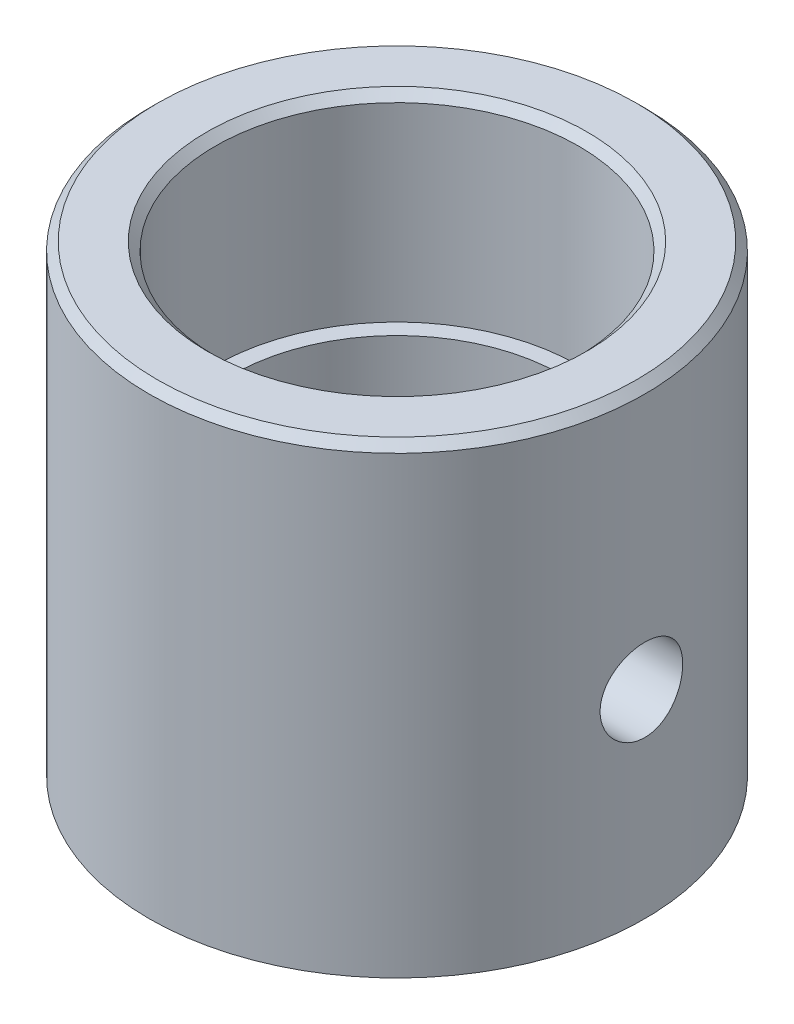
from build123d import *

# Parameters (mm, degrees)
SKETCH1_R           = 15
BOSS_EXTRUDE1_DEPTH = 28
SKETCH2_R           = 10
CUT_EXTRUDE1_DEPTH  = 27
SKETCH3_R           = 11
CUT_EXTRUDE2_DEPTH  = 12
SKETCH4_R           = 2.5
CUT_EXTRUDE3_DEPTH  = 31
CHAMFER1_SIZE       = 0.5


with BuildPart() as part:
    # Sketch1 → Boss-Extrude1 (new body)
    with BuildSketch(Plane(origin=(0, 0, 0), x_dir=(1, 0, 0), z_dir=(0, 1, 0))):
        with Locations(Location((0, 0, 0), (0, 0, 270))):
            Circle(SKETCH1_R)
    extrude(amount=BOSS_EXTRUDE1_DEPTH)

    # Sketch2 → Cut-Extrude1 (cut)
    with BuildSketch(Plane(origin=(0, 28, 0), x_dir=(1, 0, 0), z_dir=(0, 1, 0))):
        with Locations(Location((0, 0, 0), (0, 0, 270))):
            Circle(SKETCH2_R)
    extrude(amount=-CUT_EXTRUDE1_DEPTH, mode=Mode.SUBTRACT)

    # Sketch3 → Cut-Extrude2 (cut)
    with BuildSketch(Plane(origin=(0, 28, 0), x_dir=(1, 0, 0), z_dir=(0, 1, 0))):
        with Locations(Location((0, 0, 0), (0, 0, 270))):
            Circle(SKETCH3_R)
    extrude(amount=-CUT_EXTRUDE2_DEPTH, mode=Mode.SUBTRACT)

    # Sketch4 → Cut-Extrude3 (cut, symmetric)
    with BuildSketch(Plane(origin=(0, 0, 0), x_dir=(0, 0, -1), z_dir=(1, 0, 0))):
        with Locations((0, 12)):
            Circle(SKETCH4_R)
    extrude(amount=CUT_EXTRUDE3_DEPTH, both=True, mode=Mode.SUBTRACT)

    # Chamfer1
    chamfer1_edges = [part.edges().sort_by_distance(p)[0] for p in [
        (0, 28, -11),
        (0, 28, -15),
    ]]
    chamfer(chamfer1_edges, length=CHAMFER1_SIZE)


solid = part.part
